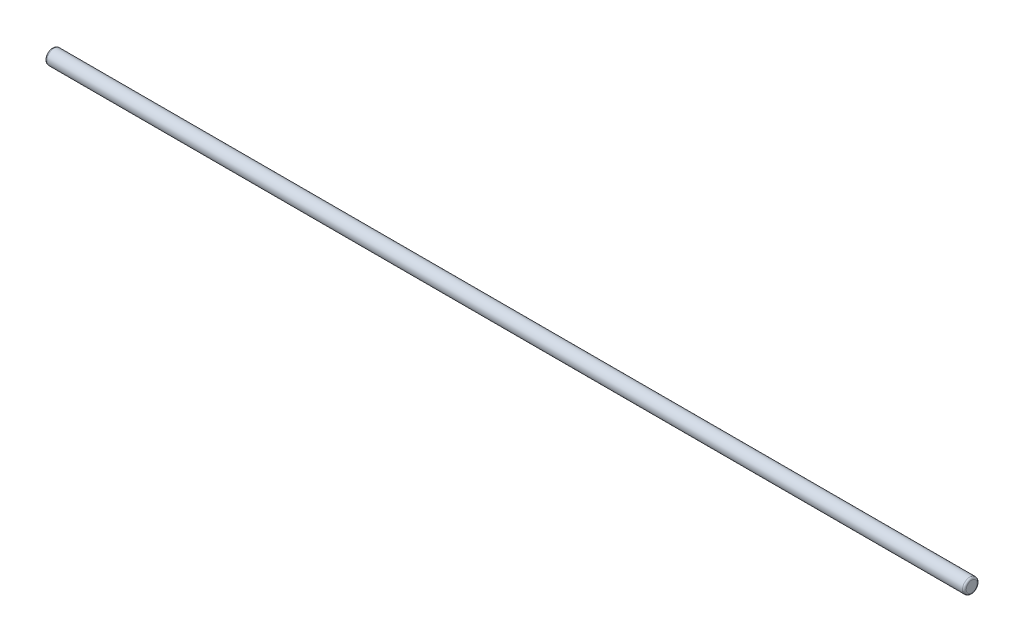
from build123d import *

# Parameters (mm, degrees)
PROFILESKETCH1_R           = 4
PROFILEBOSS_EXTRUDE1_DEPTH = 500
FILLET1_R                  = 1


with BuildPart() as part:
    # ProfileSketch1 → ProfileBoss-Extrude1 (new body)
    with BuildSketch(Plane(origin=(0, 0, 0), x_dir=(0, 0, -1), z_dir=(1, 0, 0))):
        Circle(PROFILESKETCH1_R)
    extrude(amount=PROFILEBOSS_EXTRUDE1_DEPTH)

    # Fillet1
    fillet1_edges = [part.edges().sort_by_distance(p)[0] for p in [
        (0, 0, 4),
        (500, 0, 4),
    ]]
    fillet(fillet1_edges, radius=FILLET1_R)


solid = part.part
